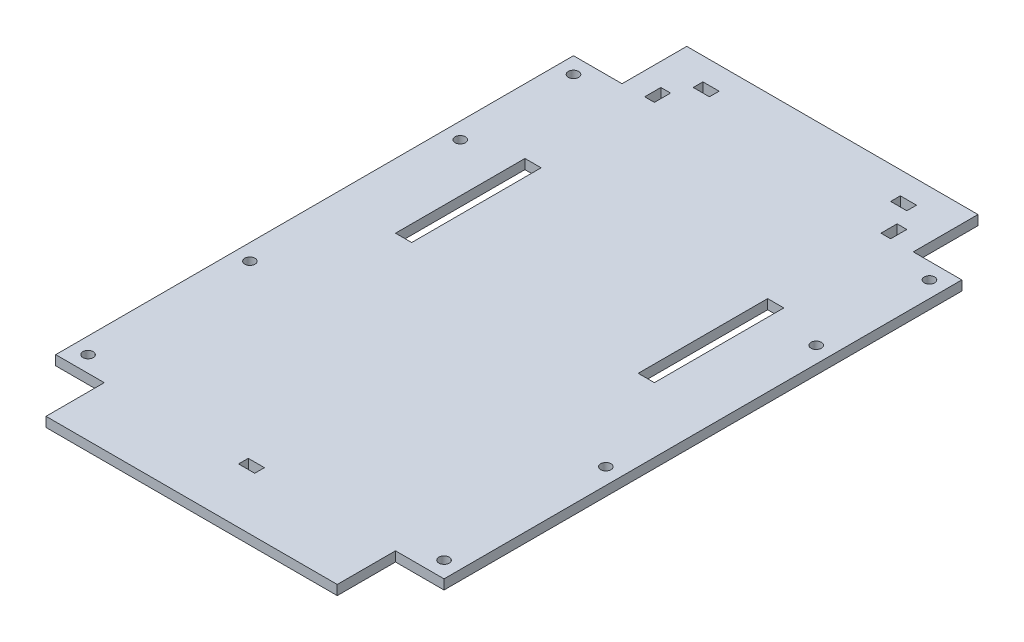
from build123d import *

# Parameters (mm, degrees)
SKETCH_2_W          = 120
SKETCH_2_H          = 110
SKETCH_2_R          = 1.6
EXTRUDE_1_DEPTH     = 3
SKETCH_4_W          = 90
SKETCH_4_H          = 198
EXTRUDE_2_DEPTH     = 3
SKETCH_7_W          = 5
SKETCH_7_H          = 3
SKETCH_7_W_2        = 3
SKETCH_7_H_2        = 5
CUT_EXTRUDE_1_DEPTH = 170.879368965
SKETCH_8_W          = 5
SKETCH_8_H          = 3
CUT_EXTRUDE_2_DEPTH = 170.879368965
SKETCH_9_W          = 5
SKETCH_9_H          = 40
CUT_EXTRUDE_3_DEPTH = 170.879368965
SKETCH_10_W         = 15
SKETCH_10_H         = 50
EXTRUDE_5_DEPTH     = 3
SKETCH_11_R         = 1.6
CUT_EXTRUDE_4_DEPTH = 170.879368965


with BuildPart() as part:
    # 草图2 → 凸台-拉伸1 (new body)
    with BuildSketch(Plane(origin=(0, 0, 0), x_dir=(1, 0, 0), z_dir=(0, 1, 0))):
        with Locations((55, 50)):
            Rectangle(SKETCH_2_W, SKETCH_2_H)
        with Locations(Location((0, 100, 0), (0, 0, 270))):
            Circle(SKETCH_2_R, mode=Mode.SUBTRACT)
        with Locations(Location((110, 100, 0), (0, 0, 270))):
            Circle(SKETCH_2_R, mode=Mode.SUBTRACT)
        with Locations(Location((0, 0, 0), (0, 0, 270))):
            Circle(SKETCH_2_R, mode=Mode.SUBTRACT)
        with Locations(Location((110, 0, 0), (0, 0, 270))):
            Circle(SKETCH_2_R, mode=Mode.SUBTRACT)
    extrude(amount=EXTRUDE_1_DEPTH)

    # 草图4 → 凸台-拉伸2 (add)
    with BuildSketch(Plane(origin=(0, 3, 0), x_dir=(1, 0, 0), z_dir=(0, 1, 0))):
        with Locations((55, 26)):
            Rectangle(SKETCH_4_W, SKETCH_4_H)
    extrude(amount=-EXTRUDE_2_DEPTH)

    # 草图7 → 切除-拉伸1 (cut, through all)
    with BuildSketch(Plane(origin=(0, 3, 0), x_dir=(1, 0, 0), z_dir=(0, 1, 0))):
        with Locations((24.5, 116.5)):
            Rectangle(SKETCH_7_W, SKETCH_7_H)
        with Locations((18.5, 107.5)):
            Rectangle(SKETCH_7_W_2, SKETCH_7_H_2)
    cut_extrude_1 = extrude(amount=-CUT_EXTRUDE_1_DEPTH, mode=Mode.SUBTRACT)

    # 镜向1: 切除-拉伸1 across plane
    add(cut_extrude_1.mirror(Plane.ZY.offset(-55)), mode=Mode.SUBTRACT)

    # 草图8 → 切除-拉伸2 (cut, through all)
    with BuildSketch(Plane(origin=(0, 3, 0), x_dir=(1, 0, 0), z_dir=(0, 1, 0))):
        with Locations((55, -54.5)):
            Rectangle(SKETCH_8_W, SKETCH_8_H)
    extrude(amount=-CUT_EXTRUDE_2_DEPTH, mode=Mode.SUBTRACT)

    # 草图9 → 切除-拉伸3 (cut, through all)
    with BuildSketch(Plane(origin=(0, 3, 0), x_dir=(1, 0, 0), z_dir=(0, 1, 0))):
        with Locations((17.5, 50)):
            Rectangle(SKETCH_9_W, SKETCH_9_H)
        with Locations((92.5, 50)):
            Rectangle(SKETCH_9_W, SKETCH_9_H)
    extrude(amount=-CUT_EXTRUDE_3_DEPTH, mode=Mode.SUBTRACT)

    # 草图10 → 凸台-拉伸5 (add)
    with BuildSketch(Plane(origin=(0, 3, 0), x_dir=(1, 0, 0), z_dir=(0, 1, 0))):
        with Locations((2.5, -30)):
            Rectangle(SKETCH_10_W, SKETCH_10_H)
        with Locations((107.5, -30)):
            Rectangle(SKETCH_10_W, SKETCH_10_H)
    extrude(amount=-EXTRUDE_5_DEPTH)

    # 草图11 → 切除-拉伸4 (cut, through all)
    with BuildSketch(Plane(origin=(0, 3, 0), x_dir=(1, 0, 0), z_dir=(0, 1, 0))):
        with Locations(Location((0, -50, 0), (0, 0, 270))):
            Circle(SKETCH_11_R)
        with Locations(Location((0, 65, 0), (0, 0, 270))):
            Circle(SKETCH_11_R)
        with Locations(Location((110, -50, 0), (0, 0, 270))):
            Circle(SKETCH_11_R)
        with Locations(Location((110, 65, 0), (0, 0, 270))):
            Circle(SKETCH_11_R)
    extrude(amount=-CUT_EXTRUDE_4_DEPTH, mode=Mode.SUBTRACT)


solid = part.part
